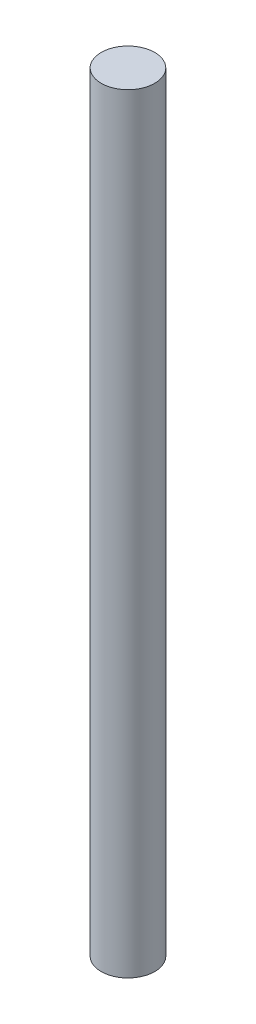
from build123d import *

# Parameters (mm, degrees)
SKETCH_1_R      = 8
EXTRUDE_1_DEPTH = 230


with BuildPart() as part:
    # 草图1 → 凸台-拉伸1 (new body)
    with BuildSketch(Plane(origin=(0, 0, 0), x_dir=(1, 0, 0), z_dir=(0, 1, 0))):
        with Locations(Location((0, 0, 0), (0, 0, 270))):
            Circle(SKETCH_1_R)
    extrude(amount=EXTRUDE_1_DEPTH)


solid = part.part
